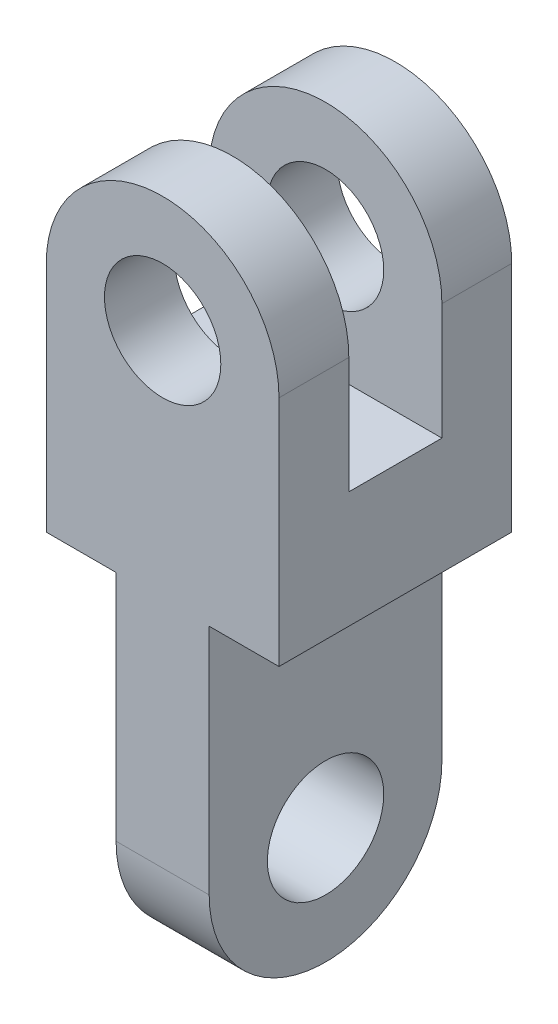
from build123d import *

# Parameters (mm, degrees)
SKETCH1_R           = 25
BOSS_EXTRUDE1_DEPTH = 40
SKETCH2_R           = 25
BOSS_EXTRUDE2_DEPTH = 30
SKETCH6_W           = 40
SKETCH6_H           = 50
BOSS_EXTRUDE3_DEPTH = 100


with BuildPart() as part:
    # Sketch1 → Boss-Extrude1 (new body)
    with BuildSketch(Plane(origin=(0, 0, 0), x_dir=(0, 0, -1), z_dir=(1, 0, 0))):
        with BuildLine():
            Line((-63.72819638, 8.260119695), (36.27180362, 8.260119695))
            Line((36.27180362, 8.260119695), (36.27180362, -91.739880305))
            ThreePointArc((36.27180362, -91.739880305), (-13.72819638, -141.739880305), (-63.72819638, -91.739880305))
            Line((-63.72819638, -91.739880305), (-63.72819638, 8.260119695))
        make_face()
        with Locations((-13.72819638, -91.739880305)):
            Circle(SKETCH1_R, mode=Mode.SUBTRACT)
    extrude(amount=BOSS_EXTRUDE1_DEPTH)

    # Sketch2 → Boss-Extrude2 (add)
    with BuildSketch(Plane.XY.offset(63.72819638)):
        with BuildLine():
            Line((0, 8.260119695), (20, 8.260119695))
            Line((20, 8.260119695), (40, 8.260119695))
            Line((40, 8.260119695), (70, 8.260119695))
            Line((70, 8.260119695), (70, 108.260119695))
            ThreePointArc((70, 108.260119695), (20, 158.260119695), (-30, 108.260119695))
            Line((-30, 108.260119695), (-30, 8.260119695))
            Line((-30, 8.260119695), (0, 8.260119695))
        make_face()
        with Locations((20, 108.260119695)):
            Circle(SKETCH2_R, mode=Mode.SUBTRACT)
    boss_extrude2 = extrude(amount=-BOSS_EXTRUDE2_DEPTH)

    # Mirror1: Boss-Extrude2 across plane
    add(boss_extrude2.mirror(Plane.XY.offset(13.72819638)))

    # Sketch6 → Boss-Extrude3 (add)
    with BuildSketch(Plane(origin=(70, 0, 0), x_dir=(0, 0, -1), z_dir=(1, 0, 0))):
        with Locations((-13.72819638, 33.260119695)):
            Rectangle(SKETCH6_W, SKETCH6_H)
    extrude(amount=-BOSS_EXTRUDE3_DEPTH)


solid = part.part
